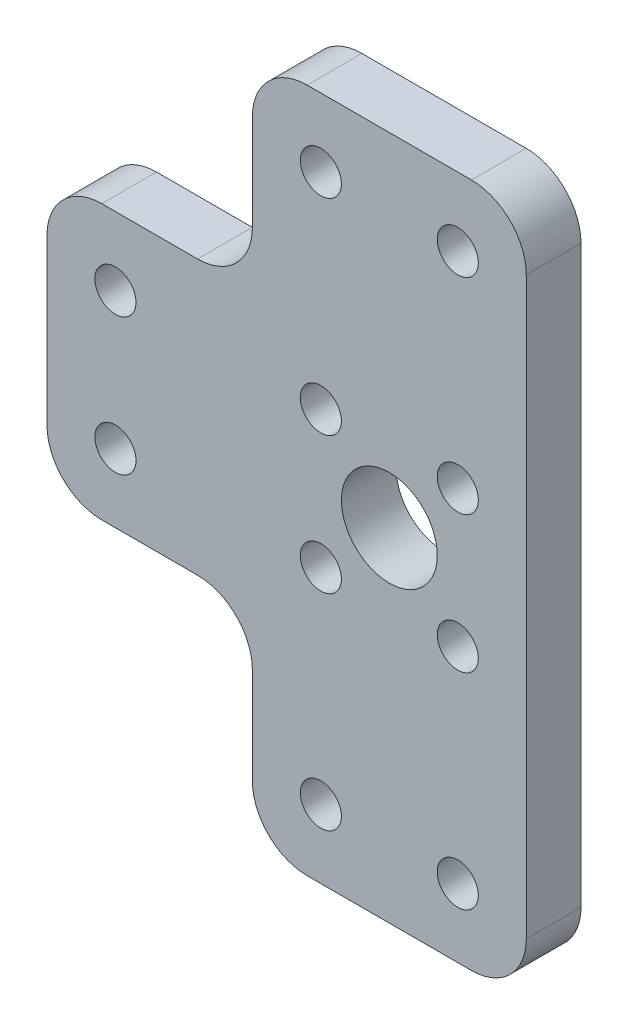
from build123d import *

# Parameters (mm, degrees)
SKETCH_1_W      = 15
SKETCH_1_H      = 20
SKETCH_1_R      = 1.5
SKETCH_1_W_2    = 20
SKETCH_1_R_2    = 3.5
SKETCH_1_H_2    = 15
EXTRUDE_1_DEPTH = 4
FILLET_1_R      = 4


with BuildPart() as part:
    # 草图1 → 凸台-拉伸1 (new body)
    # profile 1 of 4: a face of its own
    with BuildSketch(Plane.XY):
        with Locations((-17.5, 0)):
            Rectangle(SKETCH_1_W, SKETCH_1_H)
        with Locations((-20, -5)):
            Circle(SKETCH_1_R, mode=Mode.SUBTRACT)
        with Locations((-20, 5)):
            Circle(SKETCH_1_R, mode=Mode.SUBTRACT)
    # profile 2 of 4: a face of its own
    with BuildSketch(Plane.XY):
        Rectangle(SKETCH_1_W_2, SKETCH_1_H)
        with Locations((-5, -5)):
            Circle(SKETCH_1_R, mode=Mode.SUBTRACT)
        Circle(SKETCH_1_R_2, mode=Mode.SUBTRACT)
        with Locations((5, -5)):
            Circle(SKETCH_1_R, mode=Mode.SUBTRACT)
        with Locations((-5, 5)):
            Circle(SKETCH_1_R, mode=Mode.SUBTRACT)
        with Locations((5, 5)):
            Circle(SKETCH_1_R, mode=Mode.SUBTRACT)
    # profile 3 of 4: a face of its own
    with BuildSketch(Plane.XY):
        with Locations((0, 17.5)):
            Rectangle(SKETCH_1_W_2, SKETCH_1_H_2)
        with Locations((-5, 20)):
            Circle(SKETCH_1_R, mode=Mode.SUBTRACT)
        with Locations((5, 20)):
            Circle(SKETCH_1_R, mode=Mode.SUBTRACT)
    # profile 4 of 4: a face of its own
    with BuildSketch(Plane.XY):
        with Locations((0, -17.5)):
            Rectangle(SKETCH_1_W_2, SKETCH_1_H_2)
        with Locations((-5, -20)):
            Circle(SKETCH_1_R, mode=Mode.SUBTRACT)
        with Locations((5, -20)):
            Circle(SKETCH_1_R, mode=Mode.SUBTRACT)
    extrude(amount=EXTRUDE_1_DEPTH)

    # 圆角1
    fillet_1_edges = [part.edges().sort_by_distance(p)[0] for p in [
        (-25, -10, 2),
        (-25, 10, 2),
        (-10, 10, 2),
        (-10, 25, 2),
        (10, 25, 2),
        (10, -25, 2),
        (-10, -25, 2),
        (-10, -10, 2),
    ]]
    fillet(fillet_1_edges, radius=FILLET_1_R)


solid = part.part
